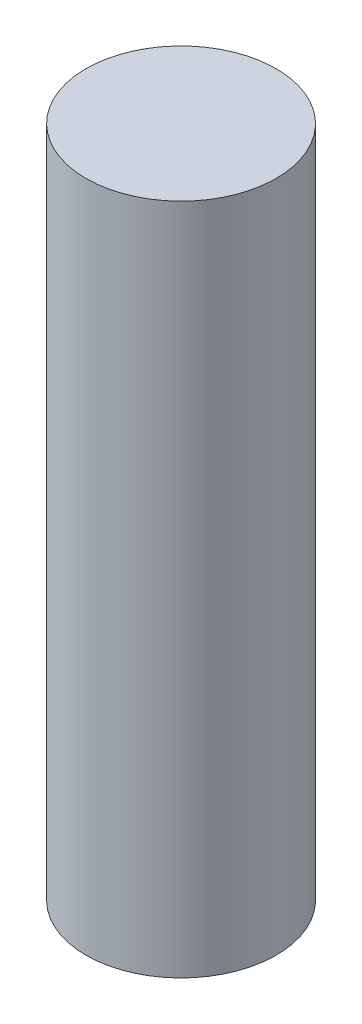
from build123d import *

# Parameters (mm, degrees)
SKETCH1_R           = 9.165
BOSS_EXTRUDE1_DEPTH = 32.425


with BuildPart() as part:
    # Sketch1 → Boss-Extrude1 (new, symmetric)
    with BuildSketch(Plane(origin=(0, 0, 0), x_dir=(1, 0, 0), z_dir=(0, 1, 0))):
        with Locations(Location((0, 0, 0), (0, 0, 270))):
            Circle(SKETCH1_R)
    extrude(amount=BOSS_EXTRUDE1_DEPTH, both=True)


solid = part.part
